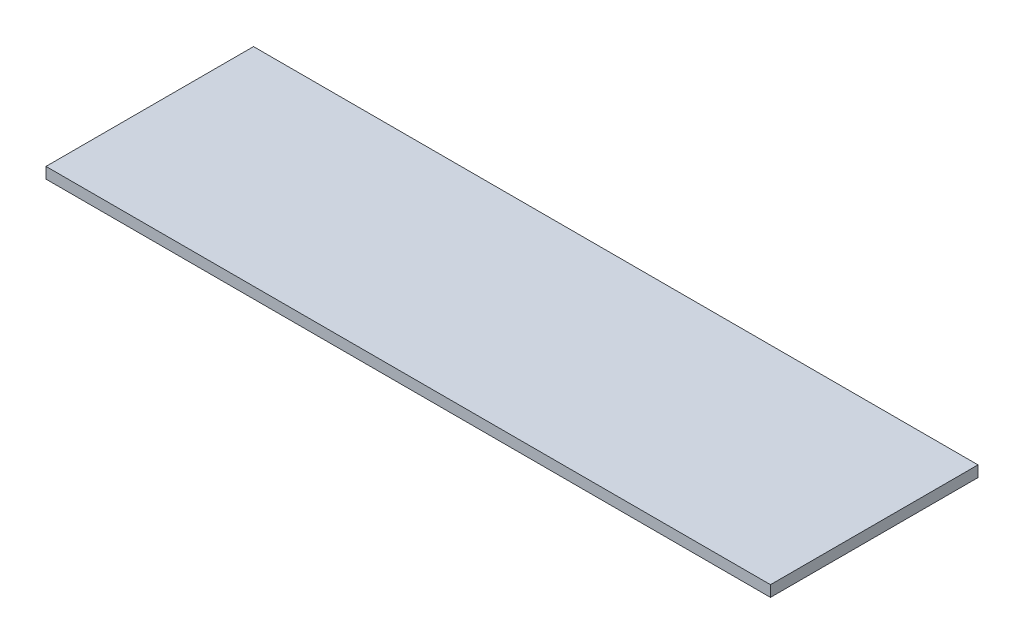
from build123d import *

# Parameters (mm, degrees)
SKETCH1_W           = 295
SKETCH1_H           = 84.5
BOSS_EXTRUDE1_DEPTH = 4.5


with BuildPart() as part:
    # Sketch1 → Boss-Extrude1 (new body)
    with BuildSketch(Plane(origin=(0, 0, 0), x_dir=(1, 0, 0), z_dir=(0, 1, 0))):
        Rectangle(SKETCH1_W, SKETCH1_H)
    extrude(amount=BOSS_EXTRUDE1_DEPTH)


solid = part.part
